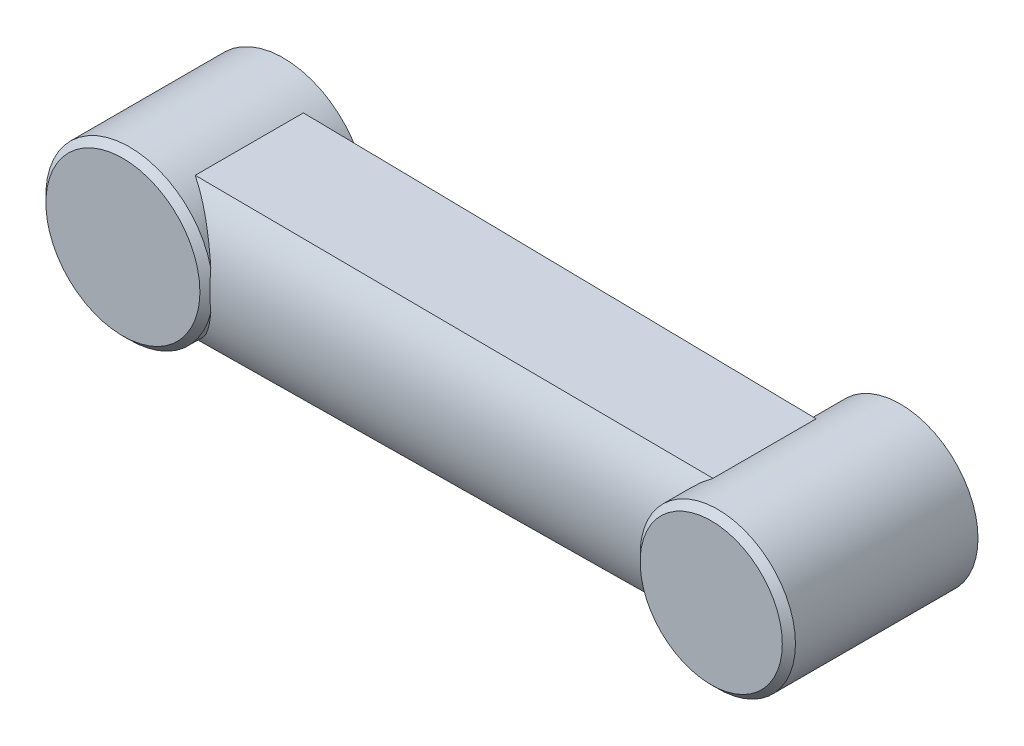
from build123d import *

# Parameters (mm, degrees)
BOSS_EXTRUDE1_DEPTH      = 61
BOSS_EXTRUDE1_DEPTH_BACK = 61
SKETCH1_R                = 63.5
CHAMFER1_SIZE            = 5
BOSS_EXTRUDE2_DEPTH      = 71.5
BOSS_EXTRUDE2_DEPTH_BACK = 72.2
SKETCH9_R                = 59
CHAMFER2_SIZE            = 5


with BuildPart() as part:
    # Sketch1 → Boss-Extrude1 (new, two sides: drawn at the far end of the back side and taken through both)
    with BuildSketch(Plane.XY.offset(-BOSS_EXTRUDE1_DEPTH_BACK)):
        Circle(SKETCH1_R)
    extrude(amount=BOSS_EXTRUDE1_DEPTH + BOSS_EXTRUDE1_DEPTH_BACK)

    # Chamfer1
    chamfer1_edges = [part.edges().sort_by_distance(p)[0] for p in [
        (-63.5, 0, 61),
    ]]
    chamfer(chamfer1_edges, length=CHAMFER1_SIZE)

    # Sketch6 for Loft1 → Loft1 section 0
    with BuildSketch(Plane.ZY):
        with BuildLine():
            Line((40, -54), (-42.5, -54))
            # circular arc as an exact rational Bezier (weights 1, cos(half-angle), 1)
            Bezier((-42.5, -54), (-75.845576298, 0), (-42.5, 54), weights=[1, 0.850849875, 1])
            Line((-42.5, 54), (40, 54))
            Bezier((40, 54), (79.351650111, 0), (40, -54), weights=[1, 0.80817386, 1])
        make_face()
    # Sketch7 for Loft1 → Loft1 section 1
    with BuildSketch(Plane(origin=(457.5, 0, 59), x_dir=(0, 0, 1), z_dir=(-1, 0, 0))):
        with BuildLine():
            Line((-19.975364888, -49.884), (-98.024635112, -49.884))
            Bezier((-98.024635112, -49.884), (-127.258443582, 0), (-98.024635112, 49.884), weights=[1, 0.862762376, 1])
            Line((-98.024635112, 49.884), (-19.975364888, 49.884))
            Bezier((-19.975364888, 49.884), (14.596903224, 0), (-19.975364888, -49.884), weights=[1, 0.821905309, 1])
        make_face()
    loft()

    # Sketch9 → Boss-Extrude2 (add, two sides: drawn at the far end of the back side and taken through both)
    with BuildSketch(Plane.XY.offset(-BOSS_EXTRUDE2_DEPTH_BACK)):
        with Locations((457.5, 0)):
            Circle(SKETCH9_R)
    extrude(amount=BOSS_EXTRUDE2_DEPTH + BOSS_EXTRUDE2_DEPTH_BACK)

    # Chamfer2
    chamfer2_edges = [part.edges().sort_by_distance(p)[0] for p in [
        (398.5, 0, 71.5),
    ]]
    chamfer(chamfer2_edges, length=CHAMFER2_SIZE)


solid = part.part
